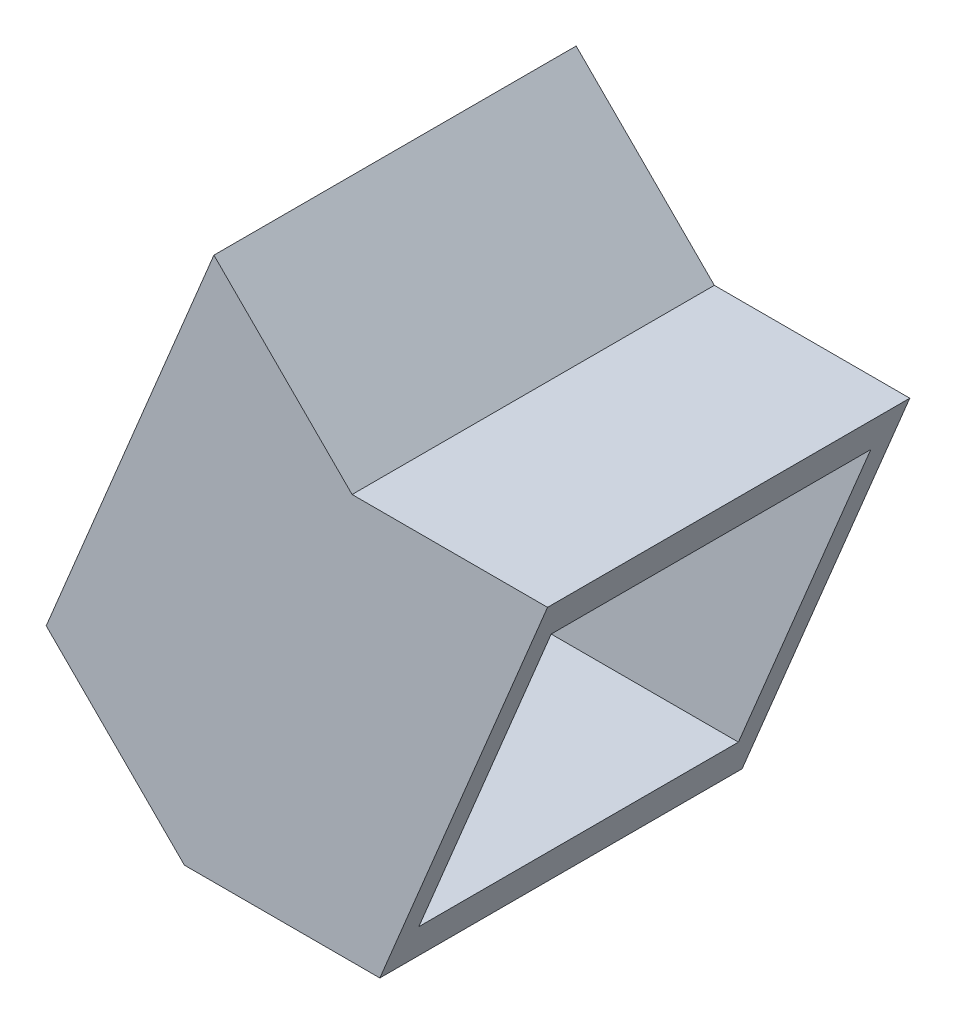
from build123d import *

# Parameters (mm, degrees)
RESSALTO_EXTRUS_O1_DEPTH   = 34
RESSALTO_EXTRUS_O1_2_DEPTH = 34
RESSALTO_EXTRUS_O2_DEPTH   = 2
RESSALTO_EXTRUS_O3_START   = 34
RESSALTO_EXTRUS_O3_DEPTH   = 2
CORTE_EXTRUS_O2_DEPTH      = 42


with BuildPart() as part:
    # Esboço1 → Ressalto-extrusão1 (new body)
    with BuildSketch(Plane.XY):
        Polygon((76.215295477, -184), (184, -76.215295477), (184, 76.215295477), (76.215295477, 184), (-76.215295477, 184), (-184, 76.215295477), (-184, -76.215295477), (-76.215295477, -184), align=None)
        Polygon((180, -74.558441227), (180, 74.558441227), (74.558441227, 180), (-74.558441227, 180), (-180, 74.558441227), (-180, -74.558441227), (-74.558441227, -180), (74.558441227, -180), align=None, mode=Mode.SUBTRACT)
    extrude(amount=RESSALTO_EXTRUS_O1_DEPTH)



with BuildPart() as body_2:
    # Esboço1 → Ressalto-extrus_o1 2 (new body)
    with BuildSketch(Plane.XY):
        Polygon((62.132034356, -150), (150, -62.132034356), (150, 62.132034356), (62.132034356, 150), (-62.132034356, 150), (-150, 62.132034356), (-150, -62.132034356), (-62.132034356, -150), align=None)
        Polygon((146, -60.475180106), (146, 60.475180106), (60.475180106, 146), (-60.475180106, 146), (-146, 60.475180106), (-146, -60.475180106), (-60.475180106, -146), (60.475180106, -146), align=None, mode=Mode.SUBTRACT)
    extrude(amount=RESSALTO_EXTRUS_O1_2_DEPTH)


with BuildPart() as part_1:
    add(part.part)

    add(body_2.part)  # Ressalto-extrusão2 merges body 2
    # Esboço1<3> → Ressalto-extrusão2 (add)
    with BuildSketch(Plane.XY):
        Polygon((74.558441227, -180), (180, -74.558441227), (180, 74.558441227), (74.558441227, 180), (-74.558441227, 180), (-180, 74.558441227), (-180, -74.558441227), (-74.558441227, -180), align=None)
        Polygon((150, -62.132034356), (150, 62.132034356), (62.132034356, 150), (-62.132034356, 150), (-150, 62.132034356), (-150, -62.132034356), (-62.132034356, -150), (62.132034356, -150), align=None, mode=Mode.SUBTRACT)
    extrude(amount=RESSALTO_EXTRUS_O2_DEPTH)

    # Esboço1<4> → Ressalto-extrusão3 (add)
    with BuildSketch(Plane.XY.offset(RESSALTO_EXTRUS_O3_START)):
        Polygon((74.558441227, -180), (180, -74.558441227), (180, 74.558441227), (74.558441227, 180), (-74.558441227, 180), (-180, 74.558441227), (-180, -74.558441227), (-74.558441227, -180), align=None)
        Polygon((150, -62.132034356), (150, 62.132034356), (62.132034356, 150), (-62.132034356, 150), (-150, 62.132034356), (-150, -62.132034356), (-62.132034356, -150), (62.132034356, -150), align=None, mode=Mode.SUBTRACT)
    extrude(amount=-RESSALTO_EXTRUS_O3_DEPTH)

    # Esboço5 → Corte-extrusão2 (cut)
    with BuildSketch(Plane.XY.offset(34)):
        Polygon((-42.132034356, -146), (-57.872149726, -184), (76.215295477, -184), (184, -76.215295477), (184, 76.215295477), (76.215295477, 184), (-76.215295477, 184), (-184, 76.215295477), (-184, -76.215295477), (-89.185858225, -171.029437252), (-73.445742855, -133.029437252), (-146, -60.475180106), (-146, 60.475180106), (-60.475180106, 146), (60.475180106, 146), (146, 60.475180106), (146, -60.475180106), (60.475180106, -146), align=None)
    extrude(amount=-CORTE_EXTRUS_O2_DEPTH, mode=Mode.SUBTRACT)


solid = part_1.part
